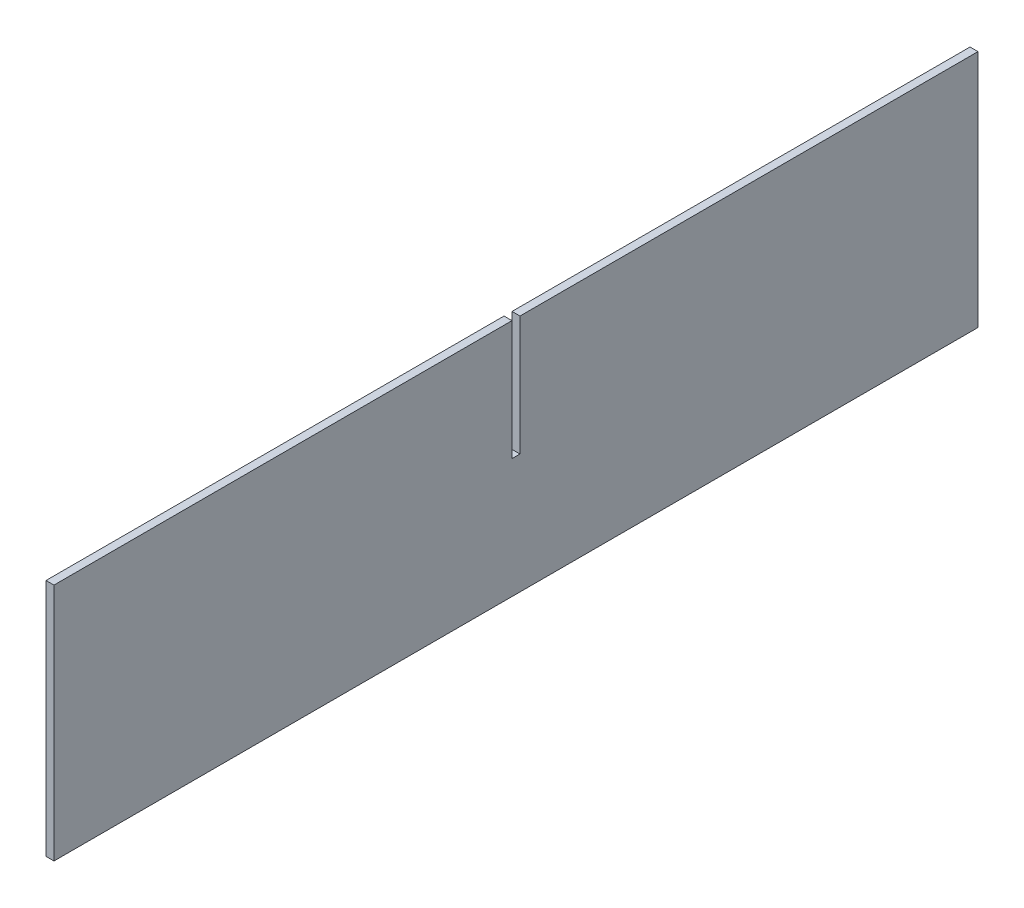
from build123d import *

# Parameters (mm, degrees)
BOSS_EXTRUDE1_DEPTH = 1.25


with BuildPart() as part:
    # Sketch1 → Boss-Extrude1 (new, symmetric)
    with BuildSketch(Plane(origin=(0, 0, 0), x_dir=(0, 0, -1), z_dir=(1, 0, 0))):
        Polygon((-145, -37.5), (145, -37.5), (145, 37.5), (1.25, 37.5), (1.25, 0), (-1.25, 0), (-1.25, 37.5), (-145, 37.5), align=None)
    extrude(amount=BOSS_EXTRUDE1_DEPTH, both=True)


solid = part.part
